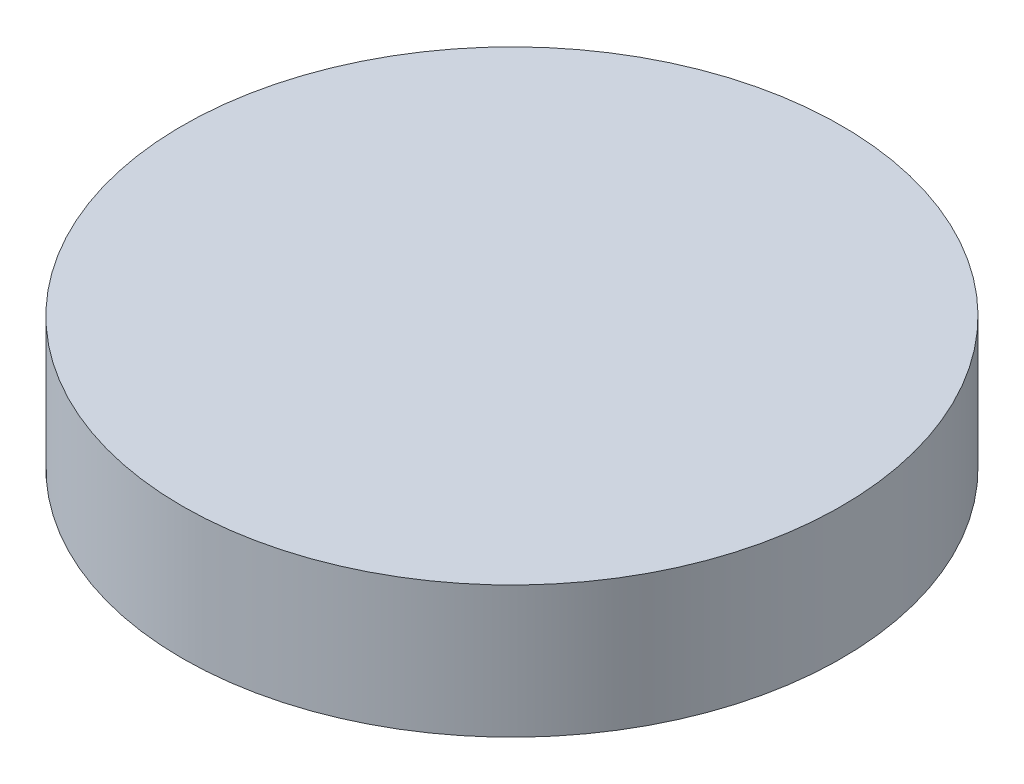
from build123d import *

# Parameters (mm, degrees)
SKETCH1_R           = 6.35
BOSS_EXTRUDE1_DEPTH = 2.54


with BuildPart() as part:
    # Sketch1 → Boss-Extrude1 (new body)
    with BuildSketch(Plane(origin=(0, 0, 0), x_dir=(1, 0, 0), z_dir=(0, 1, 0))):
        with Locations(Location((0, 0, 0), (0, 0, 270))):
            Circle(SKETCH1_R)
    extrude(amount=BOSS_EXTRUDE1_DEPTH)


solid = part.part
